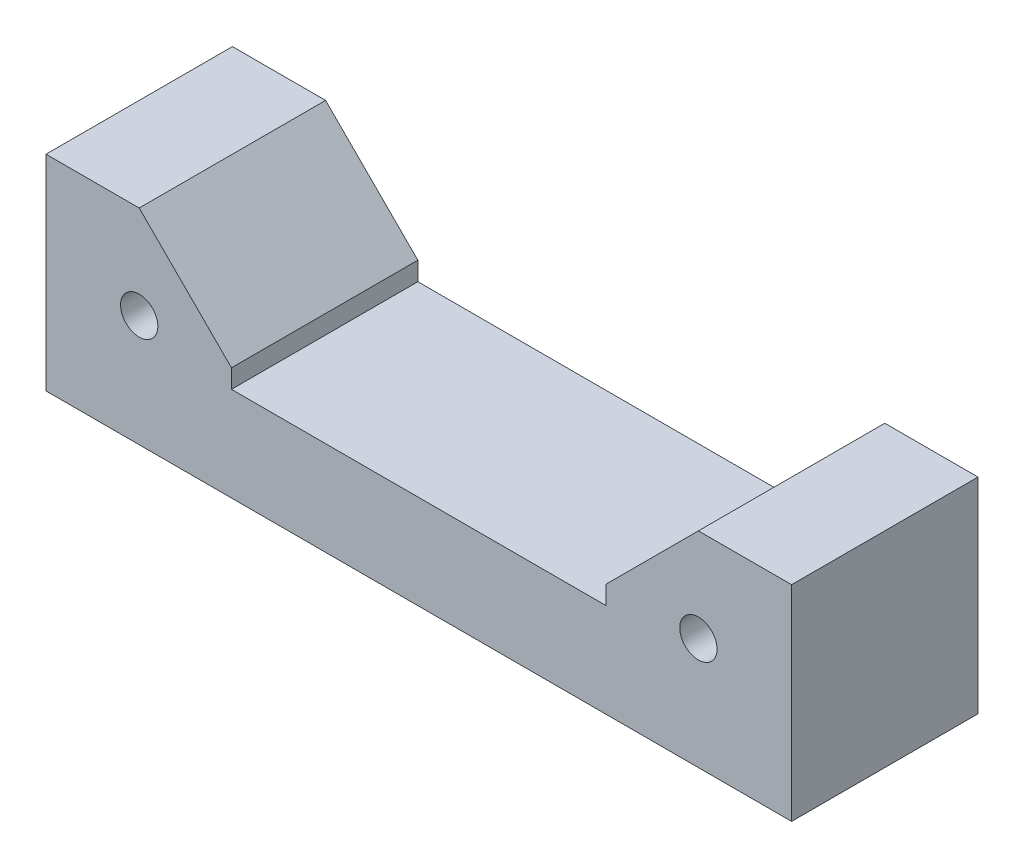
from build123d import *

# Parameters (mm, degrees)
SKETCH1_R           = 1
BOSS_EXTRUDE1_DEPTH = 5


with BuildPart() as part:
    # Sketch1 → Boss-Extrude1 (new, symmetric)
    with BuildSketch(Plane.XY):
        Polygon((-20, 0), (20, 0), (20, 11), (15, 11), (10.050252532, 6.050252532), (10.050252532, 5.050252532), (-10.050252532, 5.050252532), (-10.050252532, 6.050252532), (-15, 11), (-20, 11), align=None)
        with Locations((-15, 6)):
            Circle(SKETCH1_R, mode=Mode.SUBTRACT)
        with Locations(Location((15, 6, 0), (0, 0, 180))):
            Circle(SKETCH1_R, mode=Mode.SUBTRACT)
    extrude(amount=BOSS_EXTRUDE1_DEPTH, both=True)


solid = part.part
